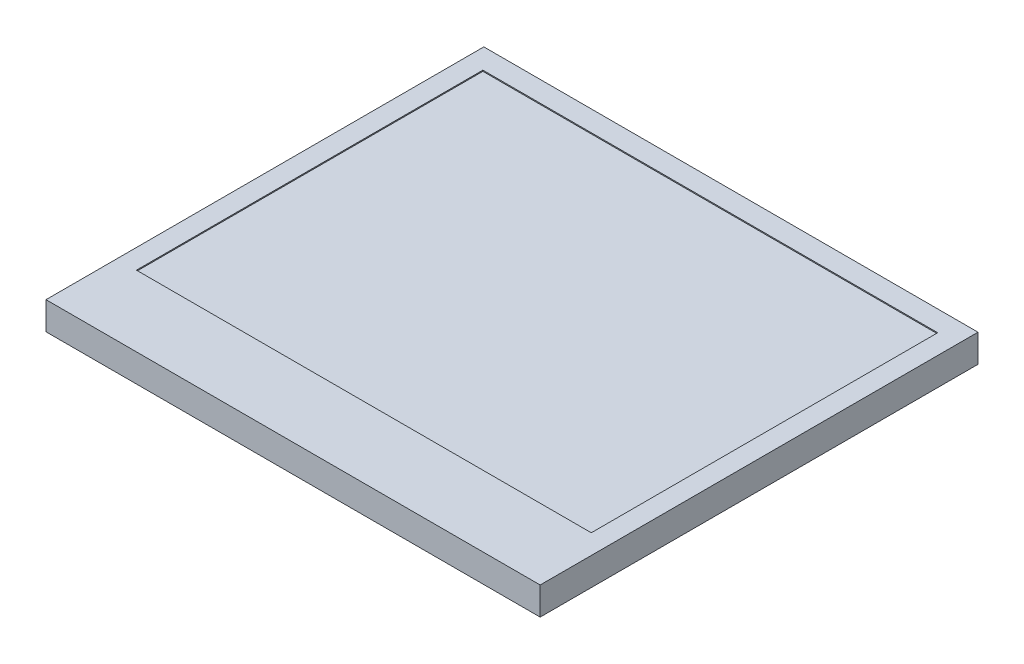
from build123d import *

# Parameters (mm, degrees)
SKETCH1_W           = 46.5
SKETCH1_H           = 41.2
BOSS_EXTRUDE1_DEPTH = 2.62
SKETCH2_W           = 42.8
SKETCH2_H           = 32.6
CUT_EXTRUDE1_DEPTH  = 0.1


with BuildPart() as part:
    # Sketch1 → Boss-Extrude1 (new body)
    with BuildSketch(Plane(origin=(0, 0, 0), x_dir=(1, 0, 0), z_dir=(0, 1, 0))):
        Rectangle(SKETCH1_W, SKETCH1_H)
    extrude(amount=BOSS_EXTRUDE1_DEPTH)

    # Sketch2 → Cut-Extrude1 (cut)
    with BuildSketch(Plane(origin=(0, 2.62, 0), x_dir=(1, 0, 0), z_dir=(0, 1, 0))):
        with Locations((0, 2.36)):
            Rectangle(SKETCH2_W, SKETCH2_H)
    extrude(amount=-CUT_EXTRUDE1_DEPTH, mode=Mode.SUBTRACT)


solid = part.part
